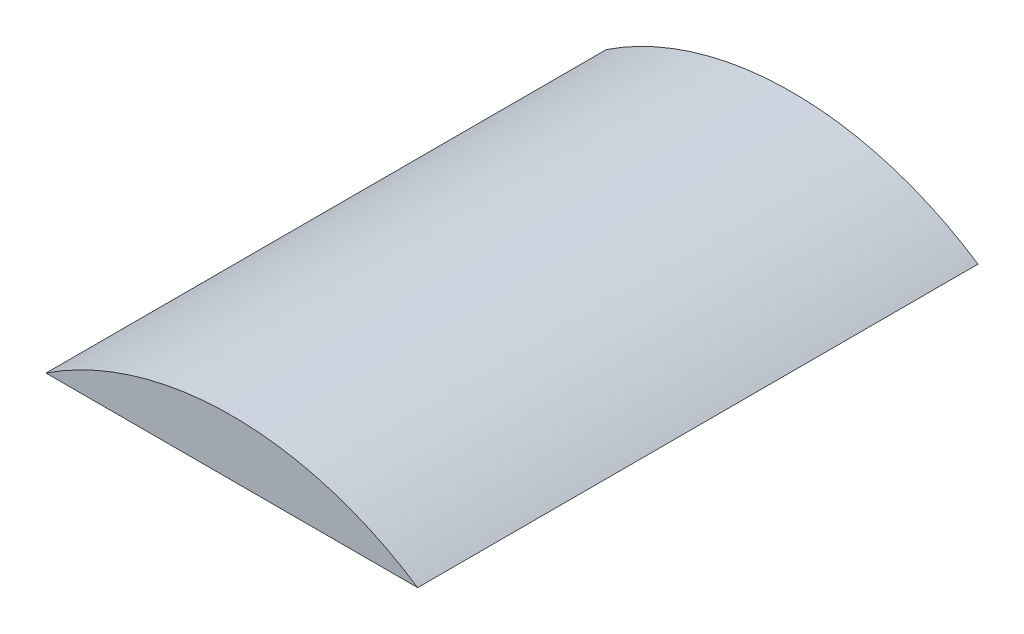
from build123d import *

# Parameters (mm, degrees)
BOSS_EXTRUDE1_DEPTH = 5


with BuildPart() as part:
    # Sketch1 → Boss-Extrude1 (new body)
    with BuildSketch(Plane.XY):
        with BuildLine():
            Line((-1.658312395, 2.5), (1.658312395, 2.5))
            ThreePointArc((1.658312395, 2.5), (0, 3), (-1.658312395, 2.5))
        make_face()
    extrude(amount=BOSS_EXTRUDE1_DEPTH)


solid = part.part
